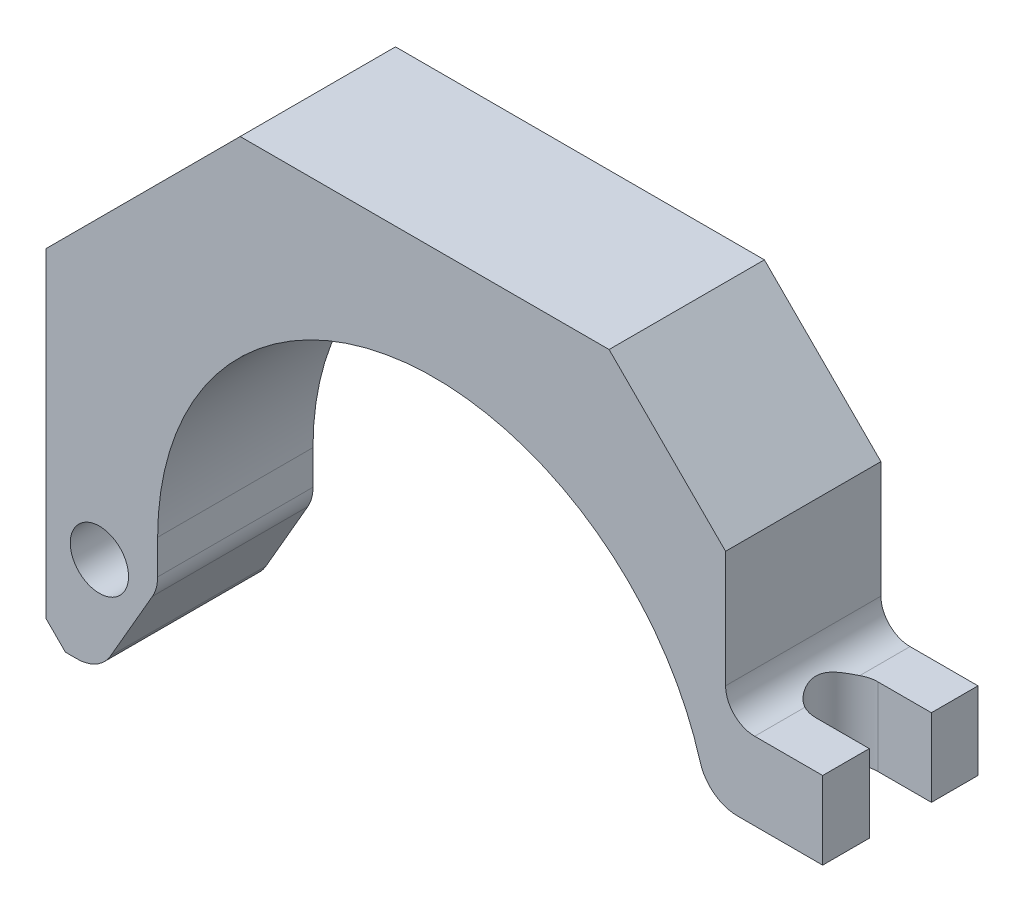
from build123d import *

# Parameters (mm, degrees)
SKETCH_1_R          = 3
EXTRUDE_1_DEPTH     = 16
CHAMFER_1_SIZE      = 6
CHAMFER_1_SIZE2     = 10.392304845
SKETCH_2_W          = 70.200678886
SKETCH_2_H          = 11.369261619
CUT_EXTRUDE_1_DEPTH = 56.506756346
CHAMFER_2_SIZE      = 20
SKETCH_4_W          = 15.06489792
SKETCH_4_H          = 29.640391265
CUT_EXTRUDE_2_DEPTH = 56.506756346
CHAMFER_3_SIZE      = 12
FILLET_1_R          = 3
FILLET_2_R          = 4
FILLET_3_R          = 4
FILLET_4_R          = 4
CHAMFER_4_SIZE      = 2
CUT_EXTRUDE_3_DEPTH = 10


with BuildPart() as part:
    # 草图1 → 凸台-拉伸1 (new body)
    with BuildSketch(Plane.XY):
        with BuildLine():
            Line((-40, 20), (40, 20))
            Line((40, 20), (40, -20))
            Line((40, -20), (28.5, -20))
            ThreePointArc((28.5, -20), (0, 8.5), (-28.5, -20))
            Line((-28.5, -20), (-28.5, -35))
            Line((-28.5, -35), (-40, -35))
            Line((-40, -35), (-40, -20))
            Line((-40, -20), (-40, 20))
        make_face()
        with Locations((-34.5, -25)):
            Circle(SKETCH_1_R, mode=Mode.SUBTRACT)
    extrude(amount=EXTRUDE_1_DEPTH)

    # 倒角1
    chamfer_1_edges = [part.edges().sort_by_distance(p)[0] for p in [
        (-28.5, -35, 8),
    ]]
    chamfer_1_side = [part.faces().sort_by_distance(p)[0] for p in [
        (-34.25, -35, 8),
    ]]
    chamfer(chamfer_1_edges, length=CHAMFER_1_SIZE, length2=CHAMFER_1_SIZE2, reference=chamfer_1_side[0])

    # 草图2 → 切除-拉伸1 (cut, through all)
    with BuildSketch(Plane.XY.offset(16)):
        with Locations((17.588251777, -20.68463081)):
            Rectangle(SKETCH_2_W, SKETCH_2_H)
    extrude(amount=-CUT_EXTRUDE_1_DEPTH, mode=Mode.SUBTRACT)

    # 倒角2
    chamfer_2_edges = [part.edges().sort_by_distance(p)[0] for p in [
        (-40, 20, 8),
    ]]
    chamfer(chamfer_2_edges, length=CHAMFER_2_SIZE)

    # 草图4 → 切除-拉伸2 (cut, through all)
    with BuildSketch(Plane.XY.offset(16)):
        with Locations((37.53244896, 7.820195633)):
            Rectangle(SKETCH_4_W, SKETCH_4_H)
    extrude(amount=-CUT_EXTRUDE_2_DEPTH, mode=Mode.SUBTRACT)

    # 倒角3
    chamfer_3_edges = [part.edges().sort_by_distance(p)[0] for p in [
        (30, 20, 8),
    ]]
    chamfer(chamfer_3_edges, length=CHAMFER_3_SIZE)

    # 圆角1
    fillet_1_edges = [part.edges().sort_by_distance(p)[0] for p in [
        (30, -7, 8),
    ]]
    fillet(fillet_1_edges, radius=FILLET_1_R)

    # 圆角2
    fillet_2_edges = [part.edges().sort_by_distance(p)[0] for p in [
        (-28.5, -24.607695155, 8),
    ]]
    fillet(fillet_2_edges, radius=FILLET_2_R)

    # 圆角3
    fillet_3_edges = [part.edges().sort_by_distance(p)[0] for p in [
        (-34.5, -35, 8),
    ]]
    fillet(fillet_3_edges, radius=FILLET_3_R)

    # 圆角4
    fillet_4_edges = [part.edges().sort_by_distance(p)[0] for p in [
        (28.057975693, -15, 8),
    ]]
    fillet(fillet_4_edges, radius=FILLET_4_R)

    # 倒角4
    chamfer_4_edges = [part.edges().sort_by_distance(p)[0] for p in [
        (-40, -35, 8),
    ]]
    chamfer(chamfer_4_edges, length=CHAMFER_4_SIZE)

    # 草图5 → 切除-拉伸3 (cut)
    with BuildSketch(Plane.XZ.offset(15)):
        with BuildLine():
            Line((34.5, 11.2), (41.178159838, 11.2))
            ThreePointArc((41.178159838, 11.2), (44.378159838, 8), (41.178159838, 4.8))
            Line((41.178159838, 4.8), (34.5, 4.8))
            ThreePointArc((34.5, 4.8), (31.3, 8), (34.5, 11.2))
        make_face()
    extrude(amount=-CUT_EXTRUDE_3_DEPTH, mode=Mode.SUBTRACT)


solid = part.part
